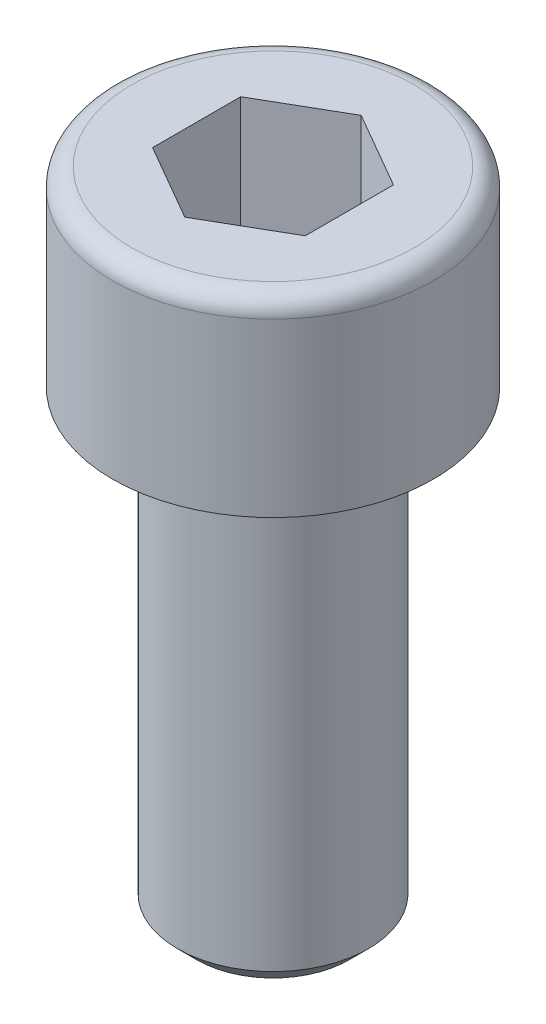
from build123d import *

# Parameters (mm, degrees)
CORTAR_EXTRUIR1_DEPTH = 3
CHAFL_N1_SIZE         = 0.5
REDONDEO1_R           = 0.5


with BuildPart() as part:
    # Croquis1 → Revolución1 (revolve)
    with BuildSketch(Plane.XY, mode=Mode.PRIVATE) as revoluci_n1_sk:
        Polygon((0, 0), (4.2, 0), (4.2, -5), (2.5, -5), (2.5, -17), (0, -17), align=None)
    revolve(revoluci_n1_sk.sketch.rotate(Axis((0, 0, 0), (0, -1, 0)), 90), axis=Axis((0, 0, 0), (0, -1, 0)))

    # Croquis2 → Cortar-Extruir1 (cut)
    with BuildSketch(Plane(origin=(0, 0, 0), x_dir=(1, 0, 0), z_dir=(0, 1, 0))):
        Polygon((2, 1.154700538), (0, 2.309401077), (-2, 1.154700538), (-2, -1.154700538), (0, -2.309401077), (2, -1.154700538), align=None)
    extrude(amount=-CORTAR_EXTRUIR1_DEPTH, mode=Mode.SUBTRACT)

    # Chaflán1
    chafl_n1_edges = [part.edges().sort_by_distance(p)[0] for p in [
        (0, -17, -2.5),
    ]]
    chamfer(chafl_n1_edges, length=CHAFL_N1_SIZE)

    # Redondeo1
    redondeo1_edges = [part.edges().sort_by_distance(p)[0] for p in [
        (0, 0, -4.2),
    ]]
    fillet(redondeo1_edges, radius=REDONDEO1_R)


solid = part.part
